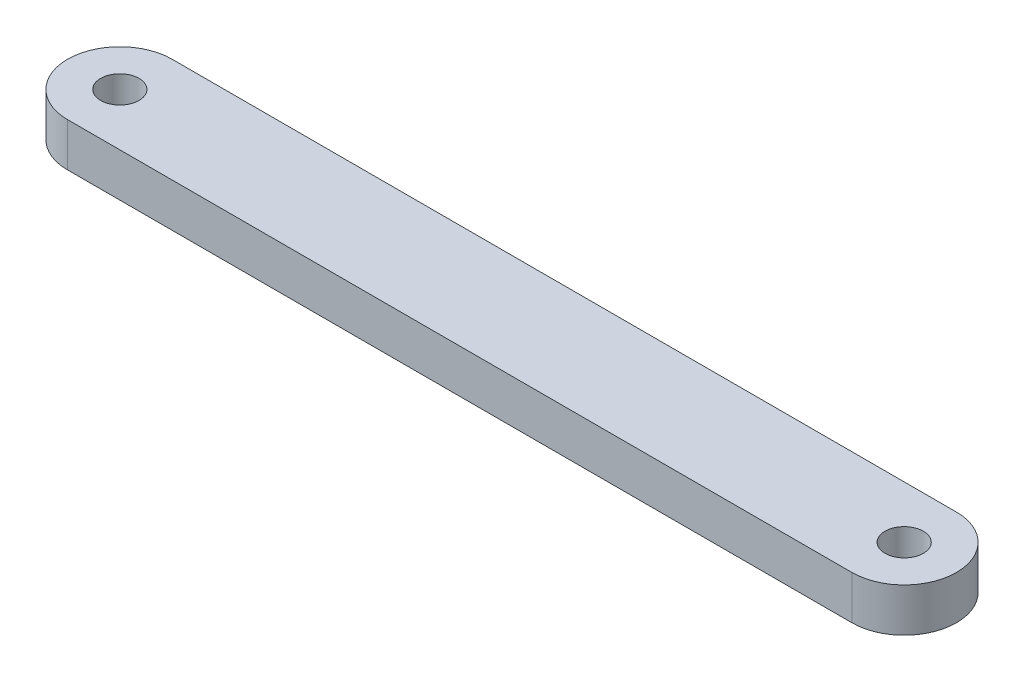
from build123d import *

# Parameters (mm, degrees)
SKETCH3_R           = 1.1
BOSS_EXTRUDE1_DEPTH = 2.5


with BuildPart() as part:
    # Sketch3 → Boss-Extrude1 (new body)
    with BuildSketch(Plane(origin=(0, 0, 0), x_dir=(-1, 0, 0), z_dir=(0, 1, 0))):
        with BuildLine():
            ThreePointArc((-22.5, 3), (-25.5, 0), (-22.5, -3))
            Line((-22.5, -3), (22.5, -3))
            ThreePointArc((22.5, -3), (25.5, 0), (22.5, 3))
            Line((22.5, 3), (-22.5, 3))
        make_face()
        with Locations(Location((-22.5, 0, 0), (0, 0, 90))):
            Circle(SKETCH3_R, mode=Mode.SUBTRACT)
        with Locations(Location((22.5, 0, 0), (0, 0, 90))):
            Circle(SKETCH3_R, mode=Mode.SUBTRACT)
    extrude(amount=BOSS_EXTRUDE1_DEPTH)


solid = part.part
